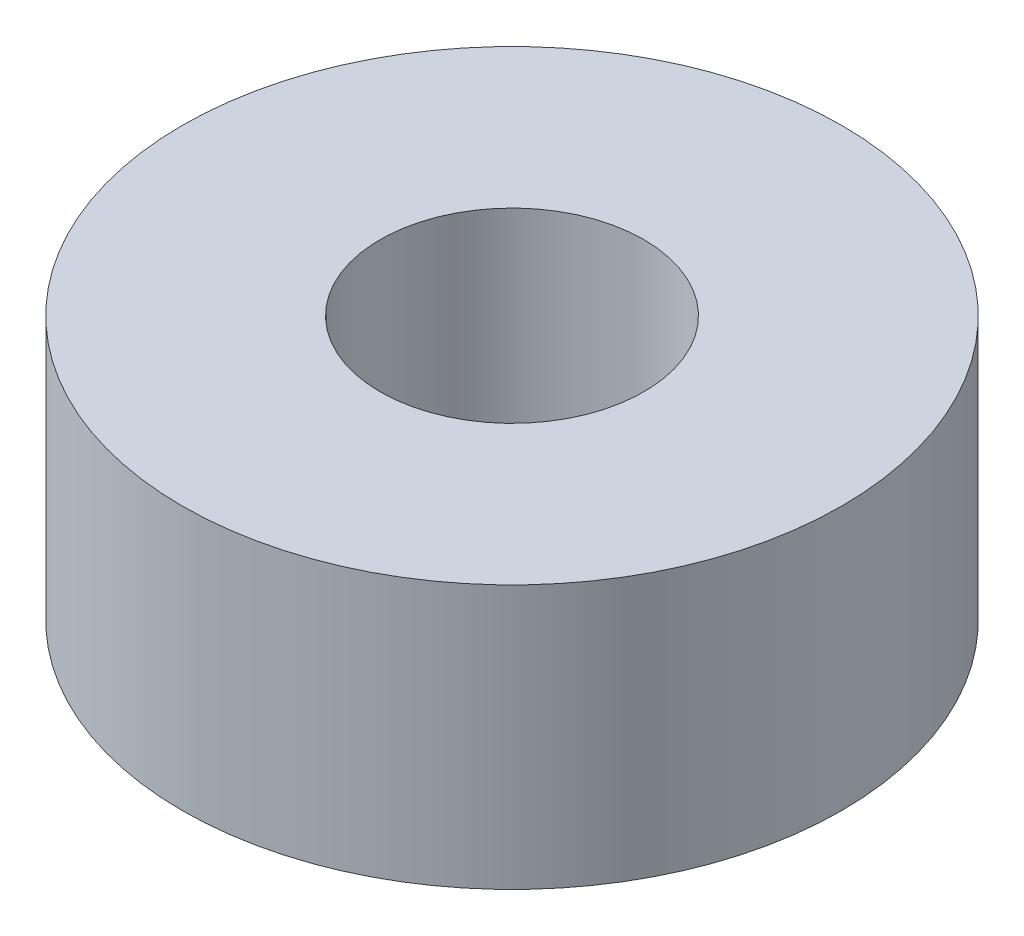
from build123d import *

# Parameters (mm, degrees)
SKETCH_1_R      = 2.5
SKETCH_1_R_2    = 1
EXTRUDE_1_DEPTH = 2


with BuildPart() as part:
    # 草图1 → 凸台-拉伸1 (new body)
    with BuildSketch(Plane(origin=(0, 0, 0), x_dir=(1, 0, 0), z_dir=(0, 1, 0))):
        with Locations(Location((0, 0, 0), (0, 0, 270))):
            Circle(SKETCH_1_R)
        with Locations(Location((0, 0, 0), (0, 0, 270))):
            Circle(SKETCH_1_R_2, mode=Mode.SUBTRACT)
    extrude(amount=EXTRUDE_1_DEPTH)


solid = part.part
